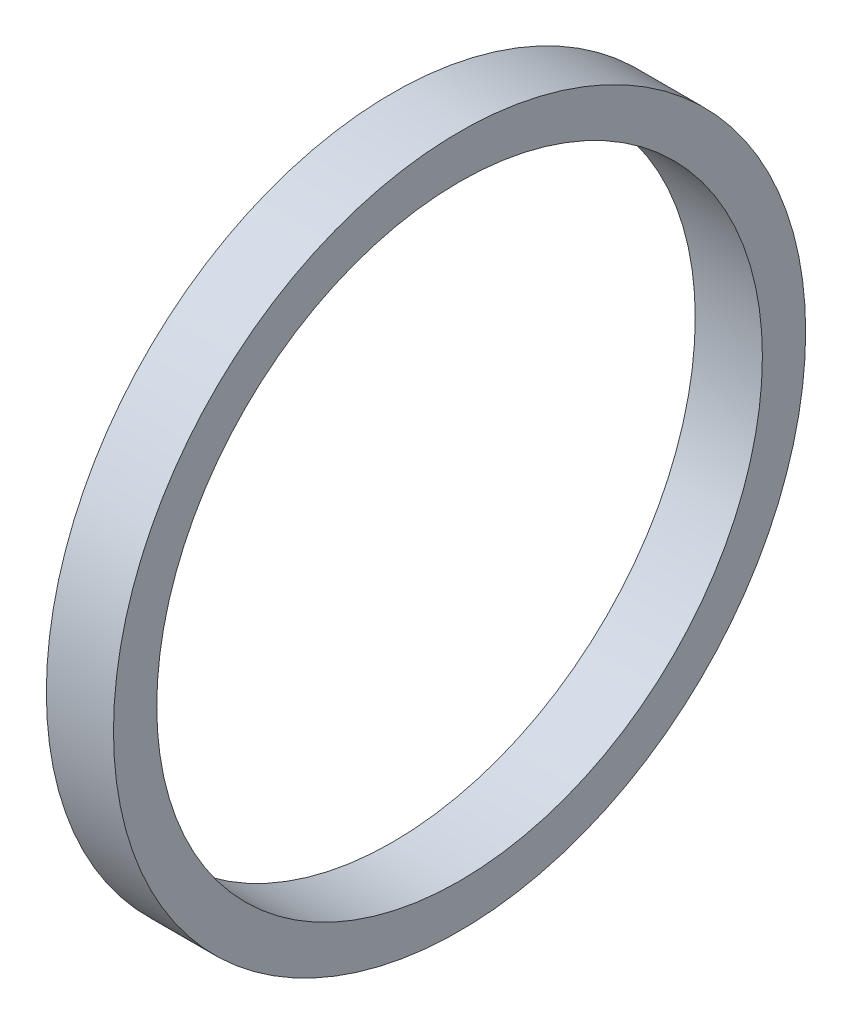
from build123d import *

# Parameters (mm, degrees)
SKETCH1_R           = 12.7
SKETCH1_R_2         = 11.1125
BOSS_EXTRUDE1_DEPTH = 2.4638


with BuildPart() as part:
    # Sketch1 → Boss-Extrude1 (new body)
    with BuildSketch(Plane(origin=(0, 0, 0), x_dir=(0, 0, -1), z_dir=(1, 0, 0))):
        Circle(SKETCH1_R)
        Circle(SKETCH1_R_2, mode=Mode.SUBTRACT)
    extrude(amount=BOSS_EXTRUDE1_DEPTH)


solid = part.part
